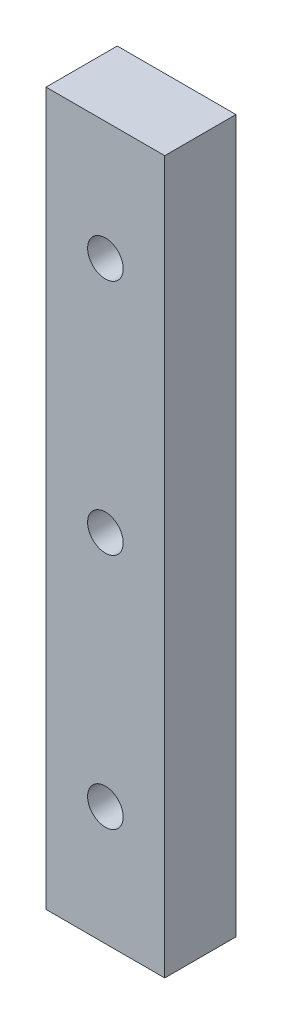
from build123d import *

# Parameters (mm, degrees)
ESQUISSE1_W             = 10
ESQUISSE1_H             = 60
EXTRUSION1_DEPTH        = 6
ESQUISSE2_R             = 1.5
ENL_V_MAT_EXTRU_1_DEPTH = 10


with BuildPart() as part:
    # Esquisse1 → Extrusion1 (new body)
    with BuildSketch(Plane.XY):
        Rectangle(ESQUISSE1_W, ESQUISSE1_H)
    extrude(amount=EXTRUSION1_DEPTH)

    # Esquisse2 → Enlèv. mat.-Extru.1 (cut)
    with BuildSketch(Plane.XY.offset(6)):
        with Locations((0, -20)):
            Circle(ESQUISSE2_R)
        Circle(ESQUISSE2_R)
        with Locations((0, 20)):
            Circle(ESQUISSE2_R)
    extrude(amount=-ENL_V_MAT_EXTRU_1_DEPTH, mode=Mode.SUBTRACT)


solid = part.part
